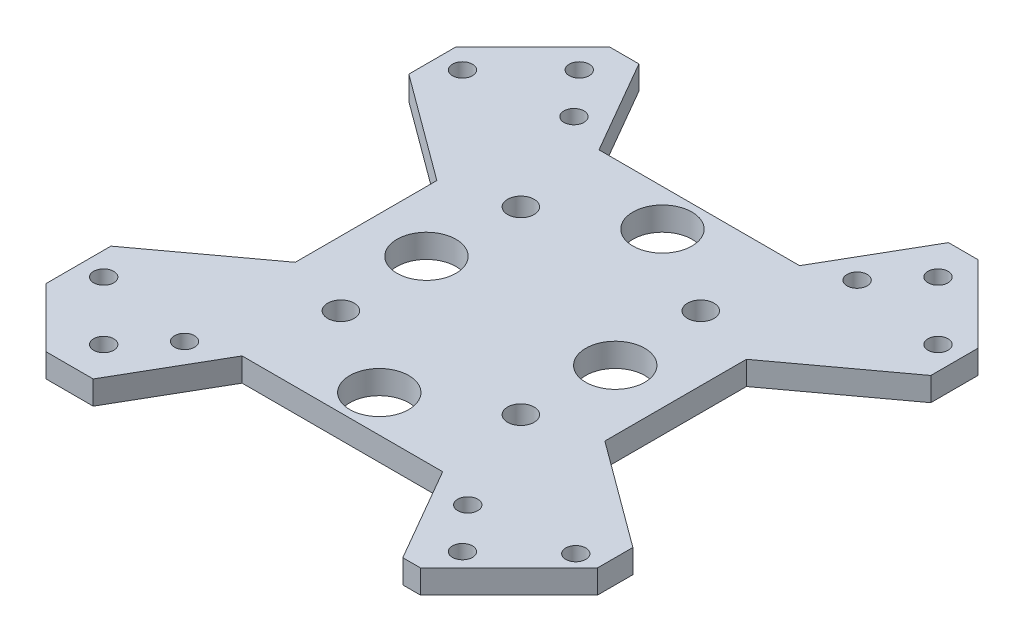
from build123d import *

# Parameters (mm, degrees)
SKETCH_1_R      = 2.25
SKETCH_1_R_2    = 1.7
SKETCH_1_R_3    = 5
SKETCH_1_R_4    = 1.69491354
EXTRUDE_1_DEPTH = 4


with BuildPart() as part:
    # 草图1 → 凸台-拉伸1 (new body)
    with BuildSketch(Plane(origin=(0, 0, 0), x_dir=(1, 0, 0), z_dir=(0, 1, 0))):
        Polygon((44.23849367, 33.250010702), (44.23849367, 25.250010702), (26.23849367, 12), (26.23849367, -12), (44.23849367, -25.250010702), (44.23849367, -31.250010702), (29.23849367, -46.250010702), (26.23849367, -46.250010702), (17, -30.248470281), (-17, -30.248470281), (-26.23849367, -46.250010702), (-34.23849367, -46.250010702), (-44.23849367, -36.250010702), (-44.23849367, -25.250010702), (-26.23849367, -12), (-26.23849367, 12), (-44.23849367, 25.250010702), (-44.23849367, 33.250010702), (-31.23849367, 46.250010702), (-26.23849367, 46.250010702), (-17, 30.248470281), (17, 30.248470281), (26.23849367, 46.250010702), (31.23849367, 46.250010702), align=None)
        with Locations(Location((-15.25, -15.25, 0), (0, 0, 270))):
            Circle(SKETCH_1_R, mode=Mode.SUBTRACT)
        with Locations(Location((-15.25, 15.25, 0), (0, 0, 270))):
            Circle(SKETCH_1_R, mode=Mode.SUBTRACT)
        with Locations(Location((15.25, -15.25, 0), (0, 0, 270))):
            Circle(SKETCH_1_R, mode=Mode.SUBTRACT)
        with Locations(Location((15.25, 15.25, 0), (0, 0, 270))):
            Circle(SKETCH_1_R, mode=Mode.SUBTRACT)
        with Locations(Location((-24, -33, 0), (0, 0, 270))):
            Circle(SKETCH_1_R_2, mode=Mode.SUBTRACT)
        with Locations(Location((-16, 0, 0), (0, 0, 270))):
            Circle(SKETCH_1_R_3, mode=Mode.SUBTRACT)
        with Locations(Location((0, 24, 0), (0, 0, 270))):
            Circle(SKETCH_1_R_3, mode=Mode.SUBTRACT)
        with Locations(Location((-30.40559154, -40.30508646, 0), (0, 0, 270))):
            Circle(SKETCH_1_R_2, mode=Mode.SUBTRACT)
        with Locations(Location((-30.40559154, 40.30508646, 0), (0, 0, 270))):
            Circle(SKETCH_1_R_2, mode=Mode.SUBTRACT)
        with Locations(Location((-40.30508646, 30.40559154, 0), (0, 0, 270))):
            Circle(SKETCH_1_R_2, mode=Mode.SUBTRACT)
        with Locations(Location((30.40559154, -40.30508646, 0), (0, 0, 270))):
            Circle(SKETCH_1_R_2, mode=Mode.SUBTRACT)
        with Locations(Location((40.30508646, -31, 0), (0, 0, 270))):
            Circle(SKETCH_1_R_4, mode=Mode.SUBTRACT)
        with Locations(Location((40.30508646, 30.40559154, 0), (0, 0, 270))):
            Circle(SKETCH_1_R_4, mode=Mode.SUBTRACT)
        with Locations(Location((30.40559154, 40.30508646, 0), (0, 0, 270))):
            Circle(SKETCH_1_R_2, mode=Mode.SUBTRACT)
        with Locations(Location((-40.30508646, -30.40559154, 0), (0, 0, 90))):
            Circle(SKETCH_1_R_2, mode=Mode.SUBTRACT)
        with Locations(Location((24, -33, 0), (0, 0, 90))):
            Circle(SKETCH_1_R_2, mode=Mode.SUBTRACT)
        with Locations(Location((24, 33, 0), (0, 0, 270))):
            Circle(SKETCH_1_R_2, mode=Mode.SUBTRACT)
        with Locations(Location((-24, 33, 0), (0, 0, 90))):
            Circle(SKETCH_1_R_2, mode=Mode.SUBTRACT)
        with Locations(Location((16, 0, 0), (0, 0, 90))):
            Circle(SKETCH_1_R_3, mode=Mode.SUBTRACT)
        with Locations(Location((0, -24, 0), (0, 0, 90))):
            Circle(SKETCH_1_R_3, mode=Mode.SUBTRACT)
    extrude(amount=EXTRUDE_1_DEPTH)


solid = part.part
